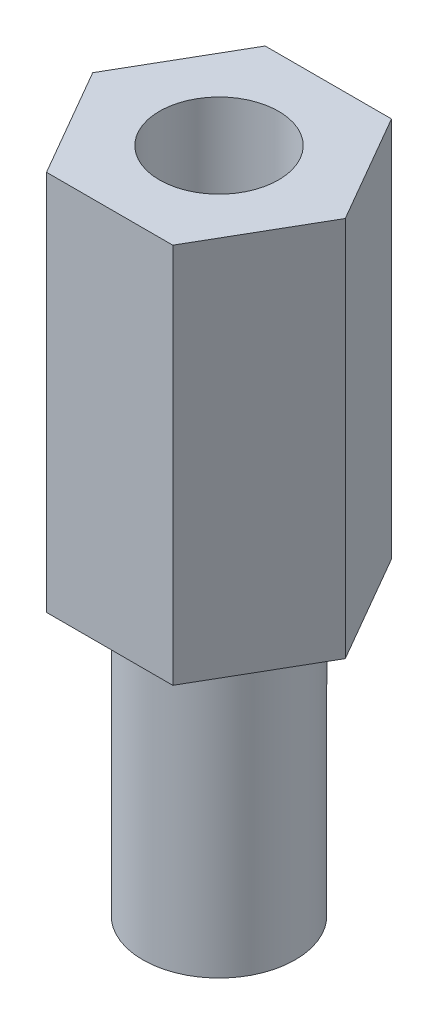
from build123d import *

# Parameters (mm, degrees)
EXTRUDE_1_DEPTH     = 8
SKETCH_6_R          = 1.6
EXTRUDE_2_DEPTH     = 6
SKETCH_7_R          = 1.25
CUT_EXTRUDE_1_DEPTH = 6


with BuildPart() as part:
    # 草图4 → 凸台-拉伸1 (new body)
    with BuildSketch(Plane(origin=(0, 0, 0), x_dir=(1, 0, 0), z_dir=(0, 1, 0))):
        Polygon((1.325, -2.29496732), (2.65, 0), (1.325, 2.29496732), (-1.325, 2.29496732), (-2.65, 0), (-1.325, -2.29496732), align=None)
    extrude(amount=EXTRUDE_1_DEPTH)

    # 草图6 → 凸台-拉伸2 (add)
    with BuildSketch(Plane(origin=(0, 0, 0), x_dir=(-1, 0, 0), z_dir=(0, -1, 0))):
        with Locations(Location((0, 0, 0), (0, 0, 270))):
            Circle(SKETCH_6_R)
    extrude(amount=EXTRUDE_2_DEPTH)

    # 草图7 → 切除-拉伸1 (cut)
    with BuildSketch(Plane(origin=(0, 8, 0), x_dir=(1, 0, 0), z_dir=(0, 1, 0))):
        with Locations(Location((0, 0, 0), (0, 0, 270))):
            Circle(SKETCH_7_R)
    extrude(amount=-CUT_EXTRUDE_1_DEPTH, mode=Mode.SUBTRACT)


solid = part.part
